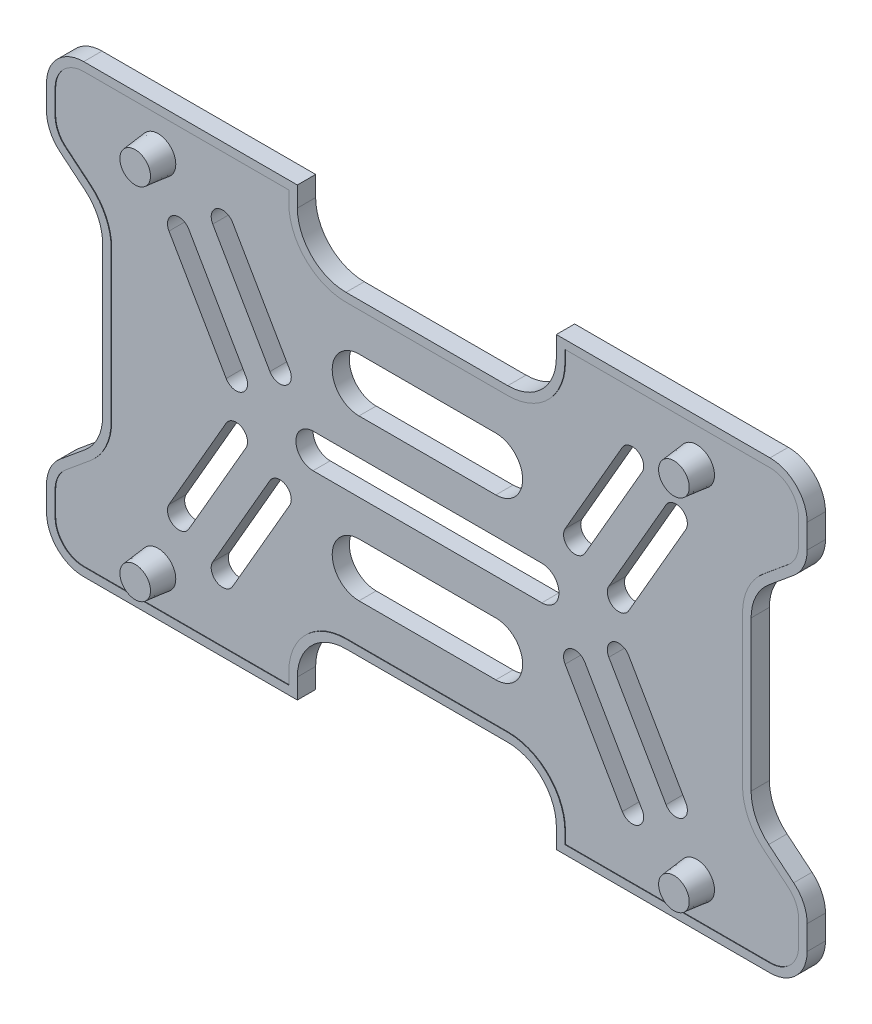
from build123d import *

# Parameters (mm, degrees)
BOSS_EXTRUDE1_DEPTH           = 1.5
SKETCH2_R                     = 3.1
BOSS_EXTRUDE2_DEPTH           = 4
BOSS_EXTRUDE2_DRAFT           = 6
BOSS_EXTRUDE2_PROFILE_2_DEPTH = 4
BOSS_EXTRUDE2_PROFILE_2_DRAFT = 6
BOSS_EXTRUDE2_PROFILE_3_DEPTH = 4
BOSS_EXTRUDE2_PROFILE_3_DRAFT = 6
BOSS_EXTRUDE2_PROFILE_4_DEPTH = 4
BOSS_EXTRUDE2_PROFILE_4_DRAFT = 6
CUT_EXTRUDE1_DEPTH            = 76.148186938
BOSS_EXTRUDE5_DEPTH           = 0.1
BOSS_EXTRUDE5_DEPTH_BACK      = 3.1


with BuildPart() as part:
    # Sketch1 → Boss-Extrude1 (new, symmetric)
    with BuildSketch(Plane.XY):
        with BuildLine():
            Line((-53, 37.5), (-30.5, 37.5))
            Line((-30.5, 37.5), (-24.141964056, 37.5))
            Line((-24.141964056, 37.5), (-24.141964056, 35.5))
            ThreePointArc((-24.141964056, 35.5), (-21.213031868, 28.428932188), (-14.141964056, 25.5))
            Line((-14.141964056, 25.5), (14.141964056, 25.5))
            ThreePointArc((14.141964056, 25.5), (21.213031868, 28.428932188), (24.141964056, 35.5))
            Line((24.141964056, 35.5), (24.141964056, 37.5))
            Line((24.141964056, 37.5), (30.5, 37.5))
            Line((30.5, 37.5), (53, 37.5))
            Line((53, 37.5), (60, 37.5))
            ThreePointArc((60, 37.5), (63.535533906, 36.035533906), (65, 32.5))
            Line((65, 32.5), (65, 28.283390528))
            ThreePointArc((65, 28.283390528), (64.524852545, 26.15601904), (63.189716221, 24.432973612))
            Line((63.189716221, 24.432973612), (58.820567558, 20.813535857))
            ThreePointArc((58.820567558, 20.813535857), (56.15029491, 17.367445), (55.2, 13.112702024))
            Line((55.2, 13.112702024), (55.2, -13.112702024))
            ThreePointArc((55.2, -13.112702024), (56.15029491, -17.367445), (58.820567558, -20.813535857))
            Line((58.820567558, -20.813535857), (63.189716221, -24.432973612))
            ThreePointArc((63.189716221, -24.432973612), (64.524852545, -26.15601904), (65, -28.283390528))
            Line((65, -28.283390528), (65, -32.5))
            ThreePointArc((65, -32.5), (63.535533906, -36.035533906), (60, -37.5))
            Line((60, -37.5), (53, -37.5))
            Line((53, -37.5), (30.5, -37.5))
            Line((30.5, -37.5), (24.141964056, -37.5))
            Line((24.141964056, -37.5), (24.141964056, -35.5))
            ThreePointArc((24.141964056, -35.5), (21.213031868, -28.428932188), (14.141964056, -25.5))
            Line((14.141964056, -25.5), (-14.141964056, -25.5))
            ThreePointArc((-14.141964056, -25.5), (-21.213031868, -28.428932188), (-24.141964056, -35.5))
            Line((-24.141964056, -35.5), (-24.141964056, -37.5))
            Line((-24.141964056, -37.5), (-30.5, -37.5))
            Line((-30.5, -37.5), (-53, -37.5))
            Line((-53, -37.5), (-60, -37.5))
            ThreePointArc((-60, -37.5), (-63.535533906, -36.035533906), (-65, -32.5))
            Line((-65, -32.5), (-65, -28.283390528))
            ThreePointArc((-65, -28.283390528), (-64.524852545, -26.15601904), (-63.189716221, -24.432973612))
            Line((-63.189716221, -24.432973612), (-58.820567558, -20.813535857))
            ThreePointArc((-58.820567558, -20.813535857), (-56.15029491, -17.367445), (-55.2, -13.112702024))
            Line((-55.2, -13.112702024), (-55.2, 13.112702024))
            ThreePointArc((-55.2, 13.112702024), (-56.15029491, 17.367445), (-58.820567558, 20.813535857))
            Line((-58.820567558, 20.813535857), (-63.189716221, 24.432973612))
            ThreePointArc((-63.189716221, 24.432973612), (-64.524852545, 26.15601904), (-65, 28.283390528))
            Line((-65, 28.283390528), (-65, 32.5))
            ThreePointArc((-65, 32.5), (-63.535533906, 36.035533906), (-60, 37.5))
            Line((-60, 37.5), (-53, 37.5))
        make_face()
    extrude(amount=BOSS_EXTRUDE1_DEPTH, both=True)


with BuildPart() as boss_extrude2_tool:
    # Sketch2 → Boss-Extrude2 (with draft: the straight prism first)
    with BuildSketch(Plane.XY.offset(1.5)):
        with Locations((47.1, -31.4)):
            Circle(SKETCH2_R)
    extrude(amount=BOSS_EXTRUDE2_DEPTH)
    # Boss-Extrude2: the draft: its side faces are tilted about the plane it starts from
    boss_extrude2_sides = [boss_extrude2_tool.faces().sort_by_distance(p)[0] for p in [
        (44, -31.4, 3.5),
    ]]
    draft(boss_extrude2_sides, Plane.XY.offset(1.5), BOSS_EXTRUDE2_DRAFT)


with BuildPart() as part_1:
    add(part.part)

    # Boss-Extrude2: add boss_extrude2_tool
    add(boss_extrude2_tool.part)


with BuildPart() as boss_extrude2_profile_2_tool:
    # Sketch2 → Boss-Extrude2 profile 2 (with draft: the straight prism first)
    with BuildSketch(Plane.XY.offset(1.5)):
        with Locations((47.1, 31.4)):
            Circle(SKETCH2_R)
    extrude(amount=BOSS_EXTRUDE2_PROFILE_2_DEPTH)
    # Boss-Extrude2 profile 2: the draft: its side faces are tilted about the plane it starts from
    boss_extrude2_profile_2_sides = [boss_extrude2_profile_2_tool.faces().sort_by_distance(p)[0] for p in [
        (44, 31.4, 3.5),
    ]]
    draft(boss_extrude2_profile_2_sides, Plane.XY.offset(1.5), BOSS_EXTRUDE2_PROFILE_2_DRAFT)


with BuildPart() as part_2:
    add(part_1.part)

    # Boss-Extrude2 profile 2: add boss_extrude2_profile_2_tool
    add(boss_extrude2_profile_2_tool.part)


with BuildPart() as boss_extrude2_profile_3_tool:
    # Sketch2 → Boss-Extrude2 profile 3 (with draft: the straight prism first)
    with BuildSketch(Plane.XY.offset(1.5)):
        with Locations((-47.1, -31.4)):
            Circle(SKETCH2_R)
    extrude(amount=BOSS_EXTRUDE2_PROFILE_3_DEPTH)
    # Boss-Extrude2 profile 3: the draft: its side faces are tilted about the plane it starts from
    boss_extrude2_profile_3_sides = [boss_extrude2_profile_3_tool.faces().sort_by_distance(p)[0] for p in [
        (-50.2, -31.4, 3.5),
    ]]
    draft(boss_extrude2_profile_3_sides, Plane.XY.offset(1.5), BOSS_EXTRUDE2_PROFILE_3_DRAFT)


with BuildPart() as part_3:
    add(part_2.part)

    # Boss-Extrude2 profile 3: add boss_extrude2_profile_3_tool
    add(boss_extrude2_profile_3_tool.part)


with BuildPart() as boss_extrude2_profile_4_tool:
    # Sketch2 → Boss-Extrude2 profile 4 (with draft: the straight prism first)
    with BuildSketch(Plane.XY.offset(1.5)):
        with Locations((-47.1, 31.4)):
            Circle(SKETCH2_R)
    extrude(amount=BOSS_EXTRUDE2_PROFILE_4_DEPTH)
    # Boss-Extrude2 profile 4: the draft: its side faces are tilted about the plane it starts from
    boss_extrude2_profile_4_sides = [boss_extrude2_profile_4_tool.faces().sort_by_distance(p)[0] for p in [
        (-50.2, 31.4, 3.5),
    ]]
    draft(boss_extrude2_profile_4_sides, Plane.XY.offset(1.5), BOSS_EXTRUDE2_PROFILE_4_DRAFT)


with BuildPart() as part_4:
    add(part_3.part)

    # Boss-Extrude2 profile 4: add boss_extrude2_profile_4_tool
    add(boss_extrude2_profile_4_tool.part)

    # Sketch3 → Cut-Extrude1 (cut, through all)
    with BuildSketch(Plane.XY.offset(1.5)):
        with BuildLine():
            Line((-20, 3), (20, 3))
            ThreePointArc((20, 3), (23, 0), (20, -3))
            Line((20, -3), (-20, -3))
            ThreePointArc((-20, -3), (-23, 0), (-20, 3))
        make_face()
        with BuildLine():
            Line((-41.722164573, 22.698244514), (-31.722164573, 5.377736438))
            ThreePointArc((-31.722164573, 5.377736438), (-32.454215381, 2.645685631), (-35.186266188, 3.377736438))
            Line((-35.186266188, 3.377736438), (-45.186266188, 20.698244514))
            ThreePointArc((-45.186266188, 20.698244514), (-44.454215381, 23.430295322), (-41.722164573, 22.698244514))
        make_face()
        with BuildLine():
            Line((-27.538829901, 8.253545046), (-37.538829901, 25.574053122))
            ThreePointArc((-37.538829901, 25.574053122), (-36.806779094, 28.30610393), (-34.074728286, 27.574053122))
            Line((-34.074728286, 27.574053122), (-24.074728286, 10.253545046))
            ThreePointArc((-24.074728286, 10.253545046), (-24.806779094, 7.521494239), (-27.538829901, 8.253545046))
        make_face()
        with BuildLine():
            Line((41.722164573, 22.698244514), (31.722164573, 5.377736438))
            ThreePointArc((31.722164573, 5.377736438), (32.454215381, 2.645685631), (35.186266188, 3.377736438))
            Line((35.186266188, 3.377736438), (45.186266188, 20.698244514))
            ThreePointArc((45.186266188, 20.698244514), (44.454215381, 23.430295322), (41.722164573, 22.698244514))
        make_face()
        with BuildLine():
            Line((27.538829901, 8.253545046), (37.538829901, 25.574053122))
            ThreePointArc((37.538829901, 25.574053122), (36.806779094, 28.30610393), (34.074728286, 27.574053122))
            Line((34.074728286, 27.574053122), (24.074728286, 10.253545046))
            ThreePointArc((24.074728286, 10.253545046), (24.806779094, 7.521494239), (27.538829901, 8.253545046))
        make_face()
        with BuildLine():
            Line((41.722164573, -22.698244514), (31.722164573, -5.377736438))
            ThreePointArc((31.722164573, -5.377736438), (32.454215381, -2.645685631), (35.186266188, -3.377736438))
            Line((35.186266188, -3.377736438), (45.186266188, -20.698244514))
            ThreePointArc((45.186266188, -20.698244514), (44.454215381, -23.430295322), (41.722164573, -22.698244514))
        make_face()
        with BuildLine():
            Line((27.538829901, -8.253545046), (37.538829901, -25.574053122))
            ThreePointArc((37.538829901, -25.574053122), (36.806779094, -28.30610393), (34.074728286, -27.574053122))
            Line((34.074728286, -27.574053122), (24.074728286, -10.253545046))
            ThreePointArc((24.074728286, -10.253545046), (24.806779094, -7.521494239), (27.538829901, -8.253545046))
        make_face()
        with BuildLine():
            Line((-41.722164573, -22.698244514), (-31.722164573, -5.377736438))
            ThreePointArc((-31.722164573, -5.377736438), (-32.454215381, -2.645685631), (-35.186266188, -3.377736438))
            Line((-35.186266188, -3.377736438), (-45.186266188, -20.698244514))
            ThreePointArc((-45.186266188, -20.698244514), (-44.454215381, -23.430295322), (-41.722164573, -22.698244514))
        make_face()
        with BuildLine():
            Line((-27.538829901, -8.253545046), (-37.538829901, -25.574053122))
            ThreePointArc((-37.538829901, -25.574053122), (-36.806779094, -28.30610393), (-34.074728286, -27.574053122))
            Line((-34.074728286, -27.574053122), (-24.074728286, -10.253545046))
            ThreePointArc((-24.074728286, -10.253545046), (-24.806779094, -7.521494239), (-27.538829901, -8.253545046))
        make_face()
        with BuildLine():
            Line((-11.966379013, 18.682496136), (11.966379013, 18.682496136))
            ThreePointArc((11.966379013, 18.682496136), (16.648875149, 14), (11.966379013, 9.317503864))
            Line((11.966379013, 9.317503864), (-11.966379013, 9.317503864))
            ThreePointArc((-11.966379013, 9.317503864), (-16.648875149, 14), (-11.966379013, 18.682496136))
        make_face()
        with BuildLine():
            Line((-11.966379013, -18.682496136), (11.966379013, -18.682496136))
            ThreePointArc((11.966379013, -18.682496136), (16.648875149, -14), (11.966379013, -9.317503864))
            Line((11.966379013, -9.317503864), (-11.966379013, -9.317503864))
            ThreePointArc((-11.966379013, -9.317503864), (-16.648875149, -14), (-11.966379013, -18.682496136))
        make_face()
    extrude(amount=-CUT_EXTRUDE1_DEPTH, mode=Mode.SUBTRACT)

    # Sketch4 → Boss-Extrude5 (add, two sides: drawn at the far end of the back side and taken through both)
    with BuildSketch(Plane.XY.offset(1.5).offset(-BOSS_EXTRUDE5_DEPTH_BACK)):
        with BuildLine():
            Line((60, 39), (22.641964056, 39))
            Line((22.641964056, 39), (22.641964056, 35.5))
            ThreePointArc((22.641964056, 35.5), (20.152371696, 29.48959236), (14.141964056, 27))
            Line((14.141964056, 27), (-14.141964056, 27))
            ThreePointArc((-14.141964056, 27), (-20.152371696, 29.48959236), (-22.641964056, 35.5))
            Line((-22.641964056, 35.5), (-22.641964056, 39))
            Line((-22.641964056, 39), (-60, 39))
            ThreePointArc((-60, 39), (-64.596194078, 37.096194078), (-66.5, 32.5))
            Line((-66.5, 32.5), (-66.5, 28.283390528))
            ThreePointArc((-66.5, 28.283390528), (-65.882308308, 25.517807594), (-64.146631087, 23.277848537))
            Line((-64.146631087, 23.277848537), (-59.777482425, 19.658410782))
            ThreePointArc((-59.777482425, 19.658410782), (-57.507750674, 16.729233554), (-56.7, 13.112702024))
            Line((-56.7, 13.112702024), (-56.7, -13.112702024))
            ThreePointArc((-56.7, -13.112702024), (-57.507750674, -16.729233554), (-59.777482425, -19.658410782))
            Line((-59.777482425, -19.658410782), (-64.146631087, -23.277848537))
            ThreePointArc((-64.146631087, -23.277848537), (-65.882308308, -25.517807594), (-66.5, -28.283390528))
            Line((-66.5, -28.283390528), (-66.5, -32.5))
            ThreePointArc((-66.5, -32.5), (-64.596194078, -37.096194078), (-60, -39))
            Line((-60, -39), (-22.641964056, -39))
            Line((-22.641964056, -39), (-22.641964056, -35.5))
            ThreePointArc((-22.641964056, -35.5), (-20.152371696, -29.48959236), (-14.141964056, -27))
            Line((-14.141964056, -27), (14.141964056, -27))
            ThreePointArc((14.141964056, -27), (20.152371696, -29.48959236), (22.641964056, -35.5))
            Line((22.641964056, -35.5), (22.641964056, -39))
            Line((22.641964056, -39), (60, -39))
            ThreePointArc((60, -39), (64.596194078, -37.096194078), (66.5, -32.5))
            Line((66.5, -32.5), (66.5, -28.283390528))
            ThreePointArc((66.5, -28.283390528), (65.882308308, -25.517807594), (64.146631087, -23.277848537))
            Line((64.146631087, -23.277848537), (59.777482425, -19.658410782))
            ThreePointArc((59.777482425, -19.658410782), (57.507750674, -16.729233554), (56.7, -13.112702024))
            Line((56.7, -13.112702024), (56.7, 13.112702024))
            ThreePointArc((56.7, 13.112702024), (57.507750674, 16.729233554), (59.777482425, 19.658410782))
            Line((59.777482425, 19.658410782), (64.146631087, 23.277848537))
            ThreePointArc((64.146631087, 23.277848537), (65.882308308, 25.517807594), (66.5, 28.283390528))
            Line((66.5, 28.283390528), (66.5, 32.5))
            ThreePointArc((66.5, 32.5), (64.596194078, 37.096194078), (60, 39))
        make_face()
        with BuildLine():
            Line((60, 37.5), (24.141964056, 37.5))
            Line((24.141964056, 37.5), (24.141964056, 35.5))
            ThreePointArc((24.141964056, 35.5), (21.213031868, 28.428932188), (14.141964056, 25.5))
            Line((14.141964056, 25.5), (-14.141964056, 25.5))
            ThreePointArc((-14.141964056, 25.5), (-21.213031868, 28.428932188), (-24.141964056, 35.5))
            Line((-24.141964056, 35.5), (-24.141964056, 37.5))
            Line((-24.141964056, 37.5), (-60, 37.5))
            ThreePointArc((-60, 37.5), (-63.535533906, 36.035533906), (-65, 32.5))
            Line((-65, 32.5), (-65, 28.283390528))
            ThreePointArc((-65, 28.283390528), (-64.524852545, 26.15601904), (-63.189716221, 24.432973612))
            Line((-63.189716221, 24.432973612), (-58.820567558, 20.813535857))
            ThreePointArc((-58.820567558, 20.813535857), (-56.15029491, 17.367445), (-55.2, 13.112702024))
            Line((-55.2, 13.112702024), (-55.2, -13.112702024))
            ThreePointArc((-55.2, -13.112702024), (-56.15029491, -17.367445), (-58.820567558, -20.813535857))
            Line((-58.820567558, -20.813535857), (-63.189716221, -24.432973612))
            ThreePointArc((-63.189716221, -24.432973612), (-64.524852545, -26.15601904), (-65, -28.283390528))
            Line((-65, -28.283390528), (-65, -32.5))
            ThreePointArc((-65, -32.5), (-63.535533906, -36.035533906), (-60, -37.5))
            Line((-60, -37.5), (-24.141964056, -37.5))
            Line((-24.141964056, -37.5), (-24.141964056, -35.5))
            ThreePointArc((-24.141964056, -35.5), (-21.213031868, -28.428932188), (-14.141964056, -25.5))
            Line((-14.141964056, -25.5), (14.141964056, -25.5))
            ThreePointArc((14.141964056, -25.5), (21.213031868, -28.428932188), (24.141964056, -35.5))
            Line((24.141964056, -35.5), (24.141964056, -37.5))
            Line((24.141964056, -37.5), (60, -37.5))
            ThreePointArc((60, -37.5), (63.535533906, -36.035533906), (65, -32.5))
            Line((65, -32.5), (65, -28.283390528))
            ThreePointArc((65, -28.283390528), (64.524852545, -26.15601904), (63.189716221, -24.432973612))
            Line((63.189716221, -24.432973612), (58.820567558, -20.813535857))
            ThreePointArc((58.820567558, -20.813535857), (56.15029491, -17.367445), (55.2, -13.112702024))
            Line((55.2, -13.112702024), (55.2, 13.112702024))
            ThreePointArc((55.2, 13.112702024), (56.15029491, 17.367445), (58.820567558, 20.813535857))
            Line((58.820567558, 20.813535857), (63.189716221, 24.432973612))
            ThreePointArc((63.189716221, 24.432973612), (64.524852545, 26.15601904), (65, 28.283390528))
            Line((65, 28.283390528), (65, 32.5))
            ThreePointArc((65, 32.5), (63.535533906, 36.035533906), (60, 37.5))
        make_face(mode=Mode.SUBTRACT)
    extrude(amount=BOSS_EXTRUDE5_DEPTH + BOSS_EXTRUDE5_DEPTH_BACK)


solid = part_4.part
